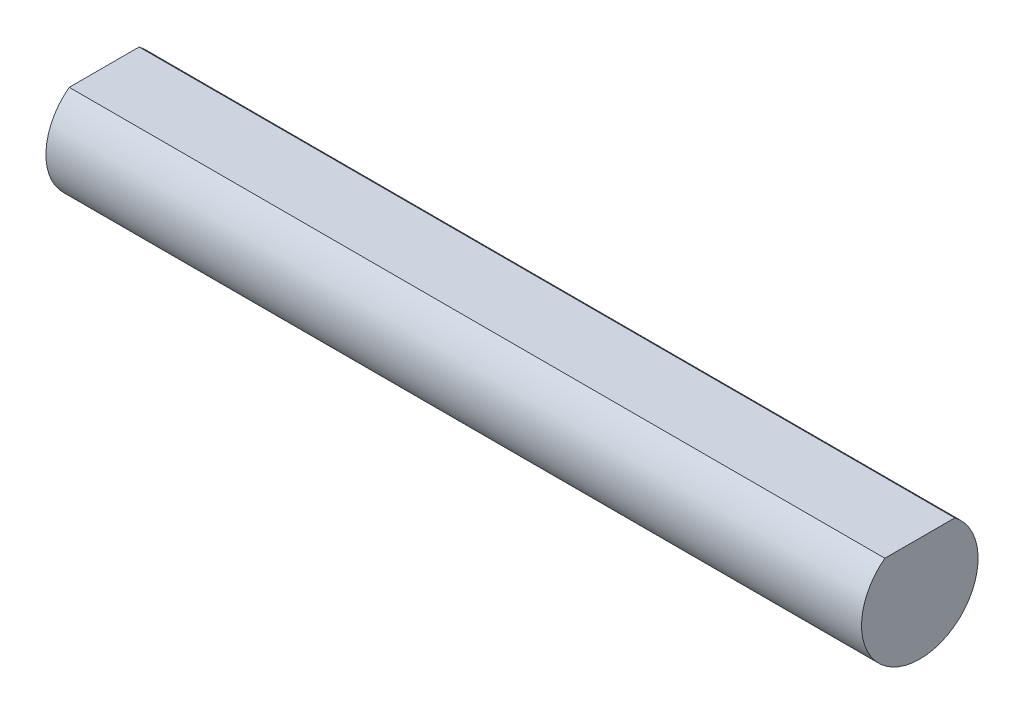
from build123d import *

# Parameters (mm, degrees)
BOSS_EXTRUDE1_DEPTH = 22.225


with BuildPart() as part:
    # Sketch1 → Boss-Extrude1 (new, symmetric)
    with BuildSketch(Plane(origin=(0, 0, 0), x_dir=(0, 0, -1), z_dir=(1, 0, 0))):
        with BuildLine():
            Line((-1.905, 2.54), (1.905, 2.54))
            ThreePointArc((1.905, 2.54), (0, -3.175), (-1.905, 2.54))
        make_face()
    extrude(amount=BOSS_EXTRUDE1_DEPTH, both=True)


solid = part.part
